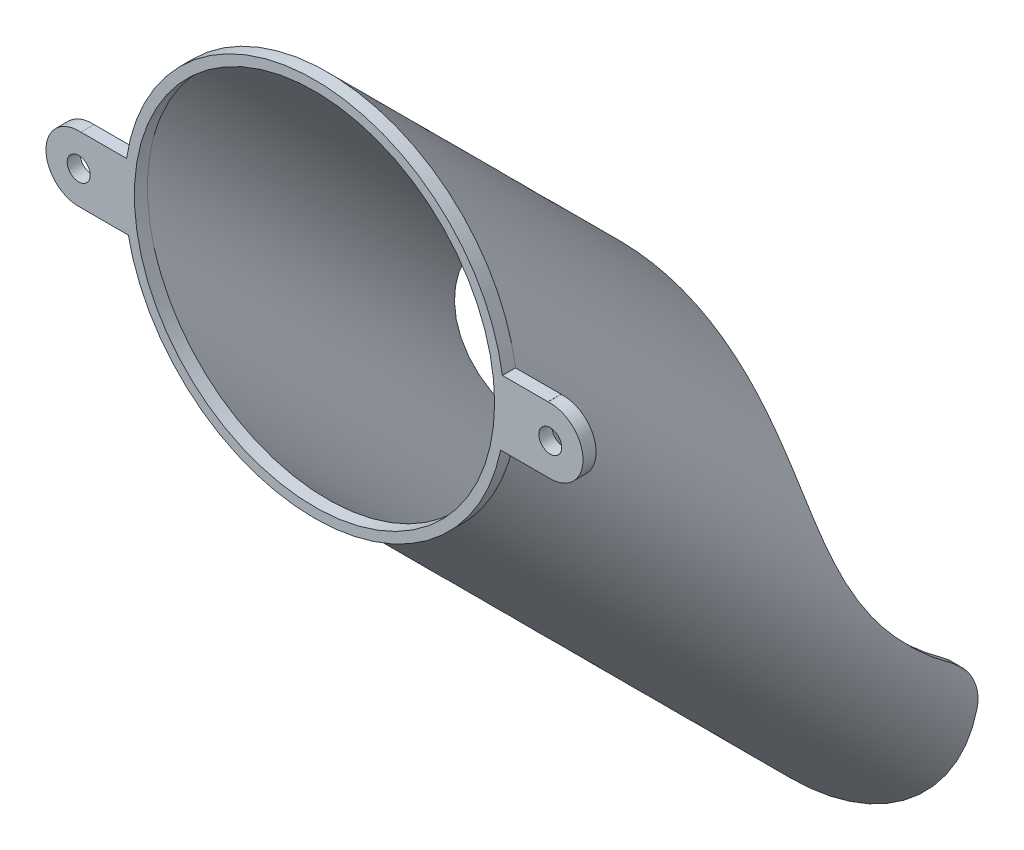
from build123d import *

# Parameters (mm, degrees)
SKETCH_1_R               = 29
SKETCH_1_R_2             = 27.5
CUT_EXTRUDE_1_DEPTH      = 126.631283249
CUT_EXTRUDE_1_DEPTH_BACK = 126.631283249
SKETCH_3_R               = 54.086675514
SKETCH_4_R               = 1.75
SKETCH_4_R_2             = 27.5
EXTRUDE_2_DEPTH          = 2
FILLET_1_R               = 10


with BuildPart() as part:
    # 掃出1: sweep along a path in 草圖2
    with BuildLine(Plane(origin=(0, 0, 0), x_dir=(0, 0, -1), z_dir=(1, 0, 0))) as sweep_1_path:
        Line((0, 0), (70.710678119, -70.710678119))
    # 草圖1 → 掃出1 (sweep)
    with BuildSketch(Plane.XY):
        Circle(SKETCH_1_R)
        Circle(SKETCH_1_R_2, mode=Mode.SUBTRACT)
    sweep(path=sweep_1_path.line)

    # 草圖3 → 除料-伸長1 (cut, two sides: drawn at the far end of the back side and taken through both)
    with BuildSketch(Plane(origin=(0, 0, 0), x_dir=(0, 0, -1), z_dir=(1, 0, 0)).offset(-CUT_EXTRUDE_1_DEPTH_BACK)):
        with Locations((98.02750034, -24.029207577)):
            Circle(SKETCH_3_R)
    extrude(amount=CUT_EXTRUDE_1_DEPTH + CUT_EXTRUDE_1_DEPTH_BACK, mode=Mode.SUBTRACT)

    # 草圖4 → 填料-伸長2 (add)
    with BuildSketch(Plane.XY):
        with BuildLine():
            ThreePointArc((-35.652777778, 4.217929102), (-41, -0.77), (-35.652777778, -5.757929102))
            ThreePointArc((-35.652777778, -5.757929102), (-35.65193287, -5.763964623), (-35.65108694, -5.77))
            Line((-35.65108694, -5.77), (-28.420188247, -5.77))
            ThreePointArc((-28.420188247, -5.77), (0, -29), (28.420188247, -5.77))
            Line((28.420188247, -5.77), (35.65108694, -5.77))
            ThreePointArc((35.65108694, -5.77), (35.65193287, -5.763964623), (35.652777778, -5.757929102))
            ThreePointArc((35.652777778, -5.757929102), (41, -0.77), (35.652777778, 4.217929102))
            ThreePointArc((35.652777778, 4.217929102), (35.65193287, 4.223964623), (35.65108694, 4.23))
            Line((35.65108694, 4.23), (28.68984315, 4.23))
            ThreePointArc((28.68984315, 4.23), (0, 29), (-28.68984315, 4.23))
            Line((-28.68984315, 4.23), (-35.65108694, 4.23))
            ThreePointArc((-35.65108694, 4.23), (-35.65193287, 4.223964623), (-35.652777778, 4.217929102))
        make_face()
        with Locations((-36, -0.77)):
            Circle(SKETCH_4_R, mode=Mode.SUBTRACT)
        Circle(SKETCH_4_R_2, mode=Mode.SUBTRACT)
        with Locations((36, -0.77)):
            Circle(SKETCH_4_R, mode=Mode.SUBTRACT)
    extrude(amount=EXTRUDE_2_DEPTH)

    # 圓角1
    fillet_1_edges = [part.edges().sort_by_distance(p)[0] for p in [
        (-28.25, -70.710678119, -70.710678119),
        (28.25, -70.710678119, -70.710678119),
    ]]
    fillet(fillet_1_edges, radius=FILLET_1_R)


solid = part.part
